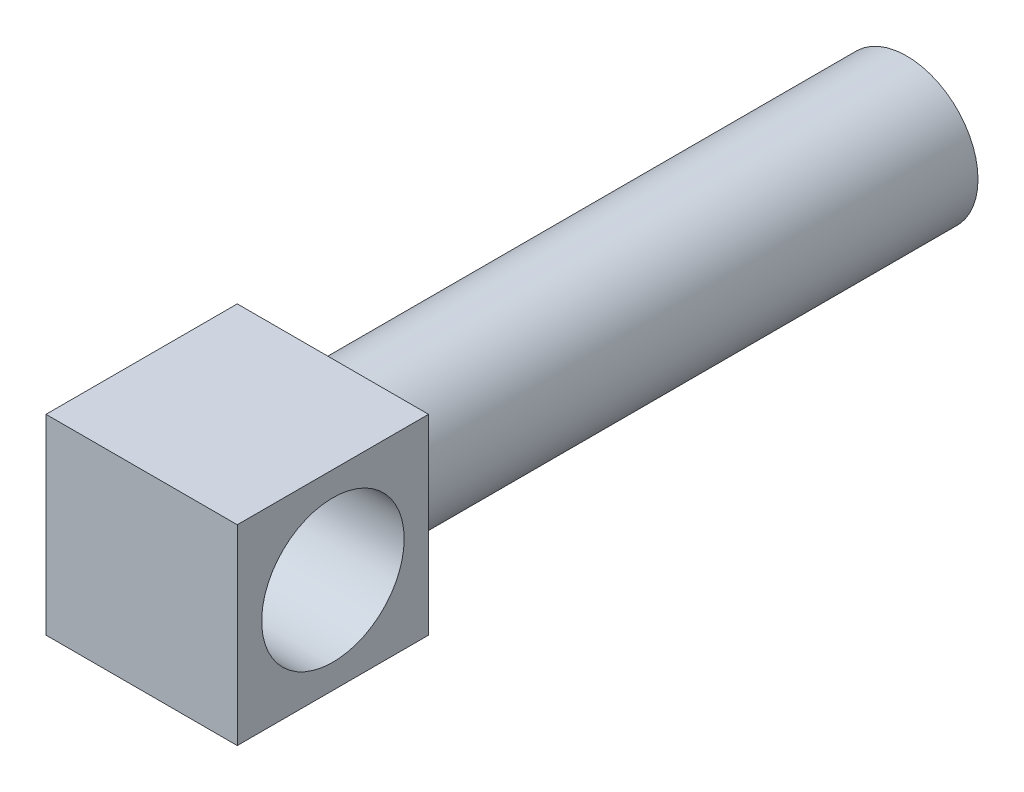
from build123d import *

# Parameters (mm, degrees)
SKETCH1_R           = 7.45
BOSS_EXTRUDE1_DEPTH = 60
SKETCH2_W           = 20
SKETCH2_H           = 20
BOSS_EXTRUDE2_DEPTH = 20
SKETCH3_R           = 7.45
CUT_EXTRUDE1_DEPTH  = 86.893170968


with BuildPart() as part:
    # Sketch1 → Boss-Extrude1 (new body)
    with BuildSketch(Plane.XY):
        with Locations((18.997949105, 14.034076201)):
            Circle(SKETCH1_R)
    extrude(amount=BOSS_EXTRUDE1_DEPTH)

    # Sketch2 → Boss-Extrude2 (add)
    with BuildSketch(Plane.XY.offset(60)):
        with Locations((18.997949105, 14.034076201)):
            Rectangle(SKETCH2_W, SKETCH2_H)
    extrude(amount=BOSS_EXTRUDE2_DEPTH)

    # Sketch3 → Cut-Extrude1 (cut, through all)
    with BuildSketch(Plane(origin=(28.997949105, 0, 0), x_dir=(0, 0, -1), z_dir=(1, 0, 0))):
        with Locations((-70, 14.034076201)):
            Circle(SKETCH3_R)
    extrude(amount=-CUT_EXTRUDE1_DEPTH, mode=Mode.SUBTRACT)


solid = part.part
